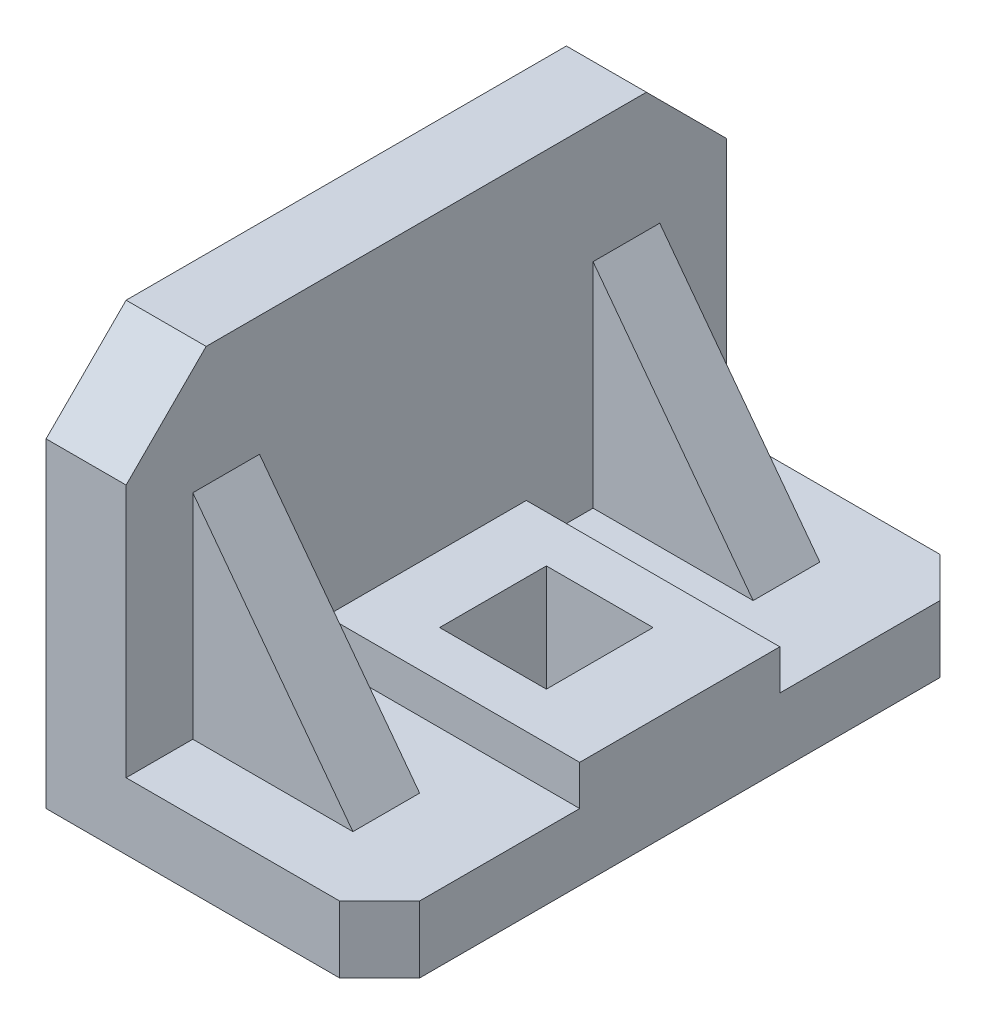
from build123d import *

# Parameters (mm, degrees)
Y_KSEKLIK_EKSTR_ZYON1_DEPTH = 2286
IZIM3_W                     = 762
IZIM3_H                     = 152.4
KES_EKSTR_ZYON4_DEPTH       = 965.2
KES_EKSTR_ZYON5_DEPTH       = 304.8
KES_EKSTR_ZYON6_DEPTH       = 304.8
IZIM11_W                    = 406.4
IZIM11_H                    = 406.4
KES_EKSTR_ZYON7_DEPTH       = 406.4
IZIM12_W                    = 254
IZIM12_H                    = 812.8
Y_KSEKLIK_EKSTR_ZYON3_DEPTH = 609.6
KES_EKSTR_ZYON10_DEPTH      = 254
KES_EKSTR_ZYON11_DEPTH      = 254


with BuildPart() as part:
    # Çizim1 → Yükseklik-Ekstrüzyon1 (new body)
    with BuildSketch(Plane.XY):
        Polygon((0, 1524), (304.8, 1524), (304.8, 406.4), (1270, 406.4), (1270, 0), (0, 0), align=None)
    extrude(amount=Y_KSEKLIK_EKSTR_ZYON1_DEPTH)

    # Çizim3 → Kes-Ekstrüzyon4 (cut)
    with BuildSketch(Plane(origin=(1270, 0, 0), x_dir=(0, 0, -1), z_dir=(1, 0, 0))):
        with Locations((-1905, 330.2)):
            Rectangle(IZIM3_W, IZIM3_H)
        with Locations((-381, 330.2)):
            Rectangle(IZIM3_W, IZIM3_H)
    extrude(amount=-KES_EKSTR_ZYON4_DEPTH, mode=Mode.SUBTRACT)

    # Çizim9 → Kes-Ekstrüzyon5 (cut)
    with BuildSketch(Plane(origin=(304.8, 0, 0), x_dir=(0, 0, -1), z_dir=(1, 0, 0))):
        Polygon((-1981.2, 1524), (-2286, 1219.2), (-2557.798170462, 1490.998170462), (-2252.998170462, 1795.798170462), align=None)
        Polygon((-304.8, 1524), (0, 1219.2), (265.402813466, 1484.602813466), (-39.397186534, 1789.402813466), align=None)
    extrude(amount=-KES_EKSTR_ZYON5_DEPTH, mode=Mode.SUBTRACT)

    # Çizim10 → Kes-Ekstrüzyon6 (cut)
    with BuildSketch(Plane(origin=(0, 254, 0), x_dir=(1, 0, 0), z_dir=(0, 1, 0))):
        Polygon((1117.6, 0), (1270, -152.4), (1478.221993626, 55.821993626), (1325.821993626, 208.221993626), align=None)
        Polygon((1270, -2133.6), (1117.6, -2286), (1313.736223321, -2482.136223321), (1466.136223321, -2329.736223321), align=None)
    extrude(amount=-KES_EKSTR_ZYON6_DEPTH, mode=Mode.SUBTRACT)

    # Çizim11 → Kes-Ekstrüzyon7 (cut)
    with BuildSketch(Plane(origin=(0, 406.4, 0), x_dir=(1, 0, 0), z_dir=(0, 1, 0))):
        with Locations((762, -1143)):
            Rectangle(IZIM11_W, IZIM11_H)
    extrude(amount=-KES_EKSTR_ZYON7_DEPTH, mode=Mode.SUBTRACT)

    # Çizim12 → Yükseklik-Ekstrüzyon3 (add)
    with BuildSketch(Plane(origin=(304.8, 0, 0), x_dir=(0, 0, -1), z_dir=(1, 0, 0))):
        with Locations((-1905, 660.4)):
            Rectangle(IZIM12_W, IZIM12_H)
        with Locations((-381, 660.4)):
            Rectangle(IZIM12_W, IZIM12_H)
    extrude(amount=Y_KSEKLIK_EKSTR_ZYON3_DEPTH)

    # Çizim14 → Kes-Ekstrüzyon10 (cut)
    with BuildSketch(Plane.XY.offset(2032)):
        Polygon((304.8, 1066.8), (914.4, 254), (1378.732090764, 602.249068073), (769.132090764, 1415.049068073), align=None)
    extrude(amount=-KES_EKSTR_ZYON10_DEPTH, mode=Mode.SUBTRACT)

    # Çizim15 → Kes-Ekstrüzyon11 (cut)
    with BuildSketch(Plane(origin=(0, 0, 254), x_dir=(-1, 0, 0), z_dir=(0, 0, -1))):
        Polygon((-304.8, 1066.8), (-914.4, 254), (-1479.518034474, 677.838525855), (-869.918034474, 1490.638525855), align=None)
    extrude(amount=-KES_EKSTR_ZYON11_DEPTH, mode=Mode.SUBTRACT)


solid = part.part
